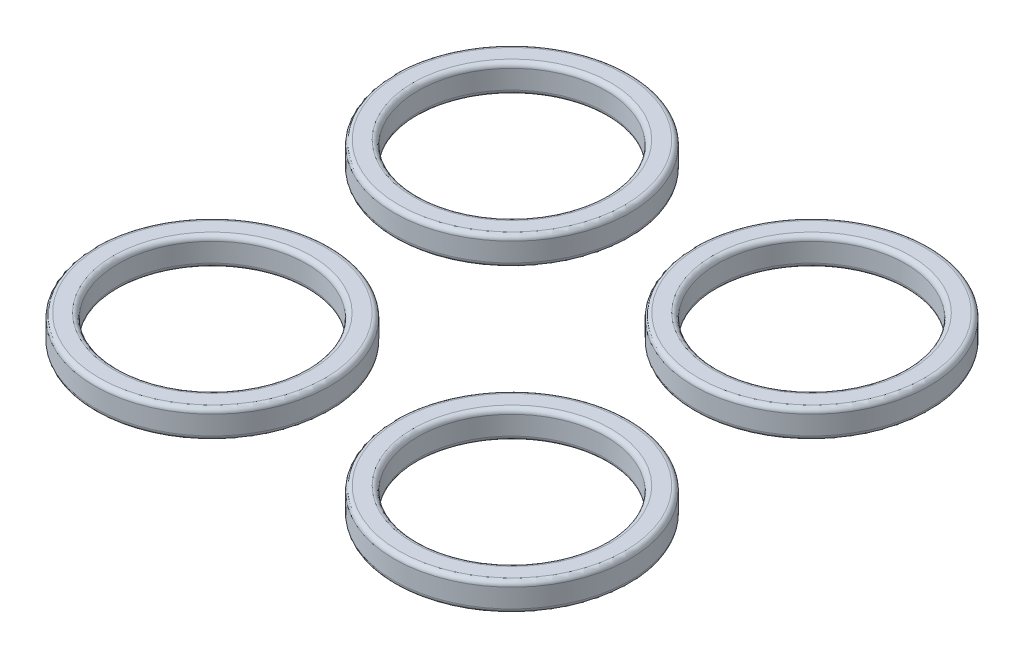
from build123d import *

# Parameters (mm, degrees)
SKETCH1_R             = 125
SKETCH1_R_2           = 100
BOSS_EXTRUDE1_DEPTH   = 30
BOSS_EXTRUDE1_2_DEPTH = 30
BOSS_EXTRUDE1_3_DEPTH = 30
BOSS_EXTRUDE1_4_DEPTH = 30
FILLET1_R             = 5
FILLET2_R             = 5
FILLET3_R             = 5
FILLET4_R             = 5


with BuildPart() as part:
    # Sketch1 → Boss-Extrude1 (new body)
    with BuildSketch(Plane(origin=(0, 0, 0), x_dir=(1, 0, 0), z_dir=(0, 1, 0))):
        with Locations(Location((-159.099025767, 159.099025767, 0), (0, 0, 270))):
            Circle(SKETCH1_R)
        with Locations(Location((-159.099025767, 159.099025767, 0), (0, 0, 270))):
            Circle(SKETCH1_R_2, mode=Mode.SUBTRACT)
    extrude(amount=BOSS_EXTRUDE1_DEPTH)

    # Fillet3
    fillet3_edges = [part.edges().sort_by_distance(p)[0] for p in [
        (-159.099025767, 0, -284.099025767),
        (-159.099025767, 30, -284.099025767),
        (-159.099025767, 0, -259.099025767),
        (-159.099025767, 30, -259.099025767),
    ]]
    fillet(fillet3_edges, radius=FILLET3_R)


with BuildPart() as body_2:
    # Sketch1 → Boss-Extrude1 2 (new body)
    with BuildSketch(Plane(origin=(0, 0, 0), x_dir=(1, 0, 0), z_dir=(0, 1, 0))):
        with Locations(Location((159.099025767, 159.099025767, 0), (0, 0, 270))):
            Circle(SKETCH1_R)
        with Locations(Location((159.099025767, 159.099025767, 0), (0, 0, 270))):
            Circle(SKETCH1_R_2, mode=Mode.SUBTRACT)
    extrude(amount=BOSS_EXTRUDE1_2_DEPTH)

    # Fillet4
    fillet4_edges = [body_2.edges().sort_by_distance(p)[0] for p in [
        (159.099025767, 0, -284.099025767),
        (159.099025767, 30, -284.099025767),
        (159.099025767, 0, -259.099025767),
        (159.099025767, 30, -259.099025767),
    ]]
    fillet(fillet4_edges, radius=FILLET4_R)


with BuildPart() as body_3:
    # Sketch1 → Boss-Extrude1 3 (new body)
    with BuildSketch(Plane(origin=(0, 0, 0), x_dir=(1, 0, 0), z_dir=(0, 1, 0))):
        with Locations(Location((-159.099025767, -159.099025767, 0), (0, 0, 270))):
            Circle(SKETCH1_R)
        with Locations(Location((-159.099025767, -159.099025767, 0), (0, 0, 270))):
            Circle(SKETCH1_R_2, mode=Mode.SUBTRACT)
    extrude(amount=BOSS_EXTRUDE1_3_DEPTH)

    # Fillet1
    fillet1_edges = [body_3.edges().sort_by_distance(p)[0] for p in [
        (-159.099025767, 0, 34.099025767),
        (-159.099025767, 30, 34.099025767),
        (-159.099025767, 0, 59.099025767),
        (-159.099025767, 30, 59.099025767),
    ]]
    fillet(fillet1_edges, radius=FILLET1_R)


with BuildPart() as body_4:
    # Sketch1 → Boss-Extrude1 4 (new body)
    with BuildSketch(Plane(origin=(0, 0, 0), x_dir=(1, 0, 0), z_dir=(0, 1, 0))):
        with Locations(Location((159.099025767, -159.099025767, 0), (0, 0, 270))):
            Circle(SKETCH1_R)
        with Locations(Location((159.099025767, -159.099025767, 0), (0, 0, 270))):
            Circle(SKETCH1_R_2, mode=Mode.SUBTRACT)
    extrude(amount=BOSS_EXTRUDE1_4_DEPTH)

    # Fillet2
    fillet2_edges = [body_4.edges().sort_by_distance(p)[0] for p in [
        (159.099025767, 0, 34.099025767),
        (159.099025767, 30, 34.099025767),
        (159.099025767, 0, 59.099025767),
        (159.099025767, 30, 59.099025767),
    ]]
    fillet(fillet2_edges, radius=FILLET2_R)


solid = Compound([part.part, body_2.part, body_3.part, body_4.part])
